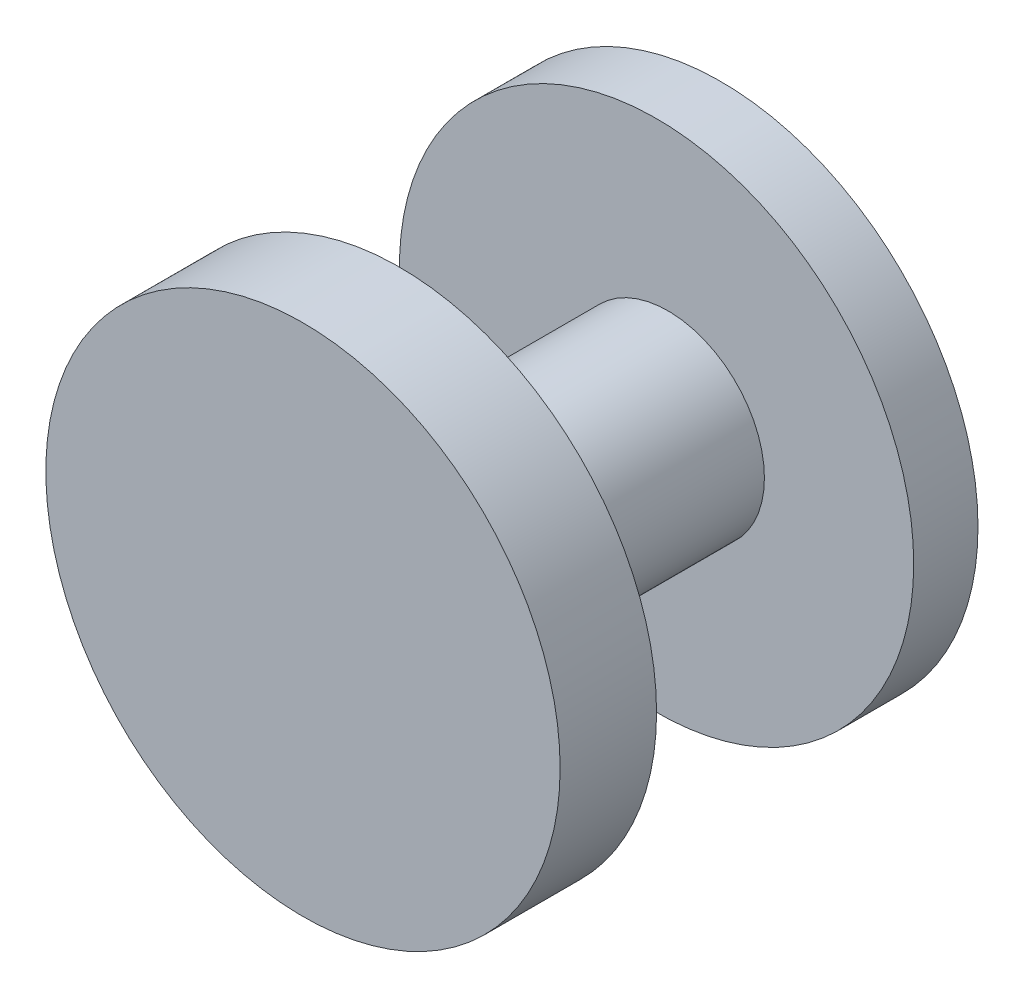
from build123d import *

# Parameters (mm, degrees)
SKETCH_1_R      = 8
EXTRUDE_1_DEPTH = 2
SKETCH_2_R      = 2.5
EXTRUDE_2_DEPTH = 1
SKETCH_3_R      = 3
EXTRUDE_3_DEPTH = 8
SKETCH_4_R      = 8
EXTRUDE_4_DEPTH = 3


with BuildPart() as part:
    # 草图1 → 凸台-拉伸1 (new body)
    with BuildSketch(Plane.XY):
        Circle(SKETCH_1_R)
    extrude(amount=EXTRUDE_1_DEPTH)

    # 草图2 → 凸台-拉伸2 (add)
    with BuildSketch(Plane(origin=(0, 0, 0), x_dir=(-1, 0, 0), z_dir=(0, 0, -1))):
        with Locations(Location((0, 0, 0), (0, 0, 180))):
            Circle(SKETCH_2_R)
    extrude(amount=EXTRUDE_2_DEPTH)

    # 草图3 → 凸台-拉伸3 (add)
    with BuildSketch(Plane.XY.offset(2)):
        with Locations((0.355322704, 0)):
            Circle(SKETCH_3_R)
    extrude(amount=EXTRUDE_3_DEPTH)

    # 草图4 → 凸台-拉伸4 (add)
    with BuildSketch(Plane.XY.offset(10)):
        Circle(SKETCH_4_R)
    extrude(amount=EXTRUDE_4_DEPTH)


solid = part.part
